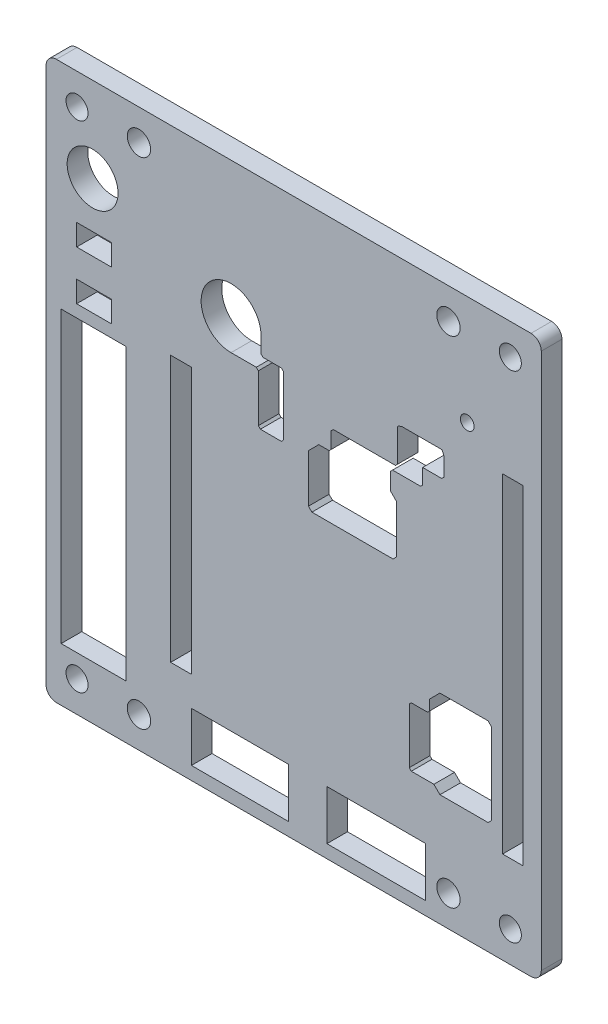
from build123d import *

# Parameters (mm, degrees)
MODEL_R                 = 1
MODEL_R_2               = 3.7
MODEL_R_3               = 1.7
MODEL_R_4               = 1.600279216
MODEL_W                 = 3
MODEL_H                 = 47.88
MODEL_H_2               = 38.677610829
MODEL_W_2               = 14.305297
MODEL_H_3               = 7.199932059
MODEL_W_3               = 14.105297
MODEL_W_4               = 5.1
MODEL_H_4               = 3.1
SALIENTE_EXTRUIR1_DEPTH = 3


with BuildPart() as part:
    # Model → Saliente-Extruir1 (new body)
    with BuildSketch(Plane.XY):
        with BuildLine():
            Line((79.069803803, 220.603820632), (79.069803803, 298.60843049))
            ThreePointArc((79.069803803, 298.60843049), (78.630463975, 299.669090662), (77.569803803, 300.10843049))
            Line((77.569803803, 300.10843049), (8.567399569, 300.10843049))
            ThreePointArc((8.567399569, 300.10843049), (7.506739397, 299.669090662), (7.067399569, 298.60843049))
            Line((7.067399569, 298.60843049), (7.067399569, 220.603820632))
            ThreePointArc((7.067399569, 220.603820632), (7.506739397, 219.54316046), (8.567399569, 219.103820632))
            Line((8.567399569, 219.103820632), (77.569803803, 219.103820632))
            ThreePointArc((77.569803803, 219.103820632), (78.630463975, 219.54316046), (79.069803803, 220.603820632))
        make_face()
        with Locations((68.304134727, 284.23112787)):
            Circle(MODEL_R, mode=Mode.SUBTRACT)
        with Locations((13.830317101, 287.723880192)):
            Circle(MODEL_R_2, mode=Mode.SUBTRACT)
        with Locations((20.566730565, 223.60348613)):
            Circle(MODEL_R_3, mode=Mode.SUBTRACT)
        with Locations((65.570138305, 223.60348613)):
            Circle(MODEL_R_3, mode=Mode.SUBTRACT)
        with Locations((11.567065067, 223.60348613)):
            Circle(MODEL_R_4, mode=Mode.SUBTRACT)
        with Locations((74.569803803, 223.60348613)):
            Circle(MODEL_R_4, mode=Mode.SUBTRACT)
        with Locations((20.566730565, 295.60843049)):
            Circle(MODEL_R_3, mode=Mode.SUBTRACT)
        with Locations((65.570138305, 295.60843049)):
            Circle(MODEL_R_3, mode=Mode.SUBTRACT)
        with Locations((74.569803803, 295.60843049)):
            Circle(MODEL_R_4, mode=Mode.SUBTRACT)
        with Locations((11.567065067, 295.60843049)):
            Circle(MODEL_R_4, mode=Mode.SUBTRACT)
        with Locations((74.943202287, 256.416250186)):
            Rectangle(MODEL_W, MODEL_H, mode=Mode.SUBTRACT)
        with Locations((26.680813222, 251.818953656)):
            Rectangle(MODEL_W, MODEL_H_2, mode=Mode.SUBTRACT)
        Polygon((9.255063306, 269.010369093), (9.256333369, 226.883193232), (18.686310635, 226.883193232), (18.685040572, 269.010369093), align=None, mode=Mode.SUBTRACT)
        with BuildLine():
            Line((37.928978937, 268.658416829), (37.930092901, 275.569446794))
            Line((37.930092901, 275.569446794), (37.630141257, 275.86944679))
            Line((37.630141257, 275.86944679), (33.962054567, 275.86944679))
            ThreePointArc((33.962054567, 275.86944679), (30.886140069, 283.295361288), (38.312054567, 280.21944679))
            Line((38.312054567, 280.21944679), (38.312054567, 277.90087731))
            Line((38.312054567, 277.90087731), (38.612054567, 277.60087731))
            Line((38.612054567, 277.60087731), (41.272484784, 277.60087731))
            Line((41.272484784, 277.60087731), (41.572484784, 277.30087731))
            Line((41.572484784, 277.30087731), (41.572484784, 268.658416833))
            Line((41.572484784, 268.658416833), (41.272484784, 268.358416833))
            Line((41.272484784, 268.358416833), (38.228930581, 268.358416833))
            Line((38.228930581, 268.358416833), (37.928978937, 268.658416829))
        make_face(mode=Mode.SUBTRACT)
        with Locations((55.052147548, 224.605565735)):
            Rectangle(MODEL_W_2, MODEL_H_3, mode=Mode.SUBTRACT)
        with Locations((35.246780171, 224.605565735)):
            Rectangle(MODEL_W_3, MODEL_H_3, mode=Mode.SUBTRACT)
        with Locations((14.057658355, 272.349769149)):
            Rectangle(MODEL_W_4, MODEL_H_4, mode=Mode.SUBTRACT)
        with Locations((14.057658355, 279.495142856)):
            Rectangle(MODEL_W_4, MODEL_H_4, mode=Mode.SUBTRACT)
        Polygon((45.217053505, 262.162824271), (45.717053505, 261.662824271), (57.517053505, 261.662824271), (58.017053505, 262.162824271), (58.017053505, 269.162824271), (57.139240746, 270.040637031), (57.139240746, 272.521816974), (57.439240746, 272.821816974), (61.516534187, 272.821816974), (61.816534188, 273.121816974), (61.816534188, 275.340900661), (64.597764426, 275.340900661), (64.897764426, 275.640900661), (64.897764426, 278.38346156), (64.685649489, 278.89561069), (64.596997018, 278.984277451), (58.773973289, 278.984277451), (58.261824159, 278.772162514), (58.173924933, 278.684277455), (58.173157398, 273.922486249), (57.873109042, 273.622486253), (48.826048419, 273.622486253), (48.526048419, 273.322486253), (48.526048419, 270.962824271), (48.226048419, 270.662824271), (46.717053505, 270.662824271), (45.217053505, 269.162824271), align=None, mode=Mode.SUBTRACT)
        Polygon((63.45410467, 236.265050938), (60.172255448, 236.265050938), (59.872255448, 236.565050938), (59.872255448, 244.578243265), (60.172255448, 244.878243265), (62.53191743, 244.878243265), (62.83191743, 245.178243265), (62.83191743, 246.687238178), (64.33191743, 248.187238178), (71.33191743, 248.187238178), (71.83191743, 247.687238178), (71.83191743, 235.887238179), (71.33191743, 235.387238179), (64.33191743, 235.387238179), align=None, mode=Mode.SUBTRACT)
    extrude(amount=SALIENTE_EXTRUIR1_DEPTH)


solid = part.part
